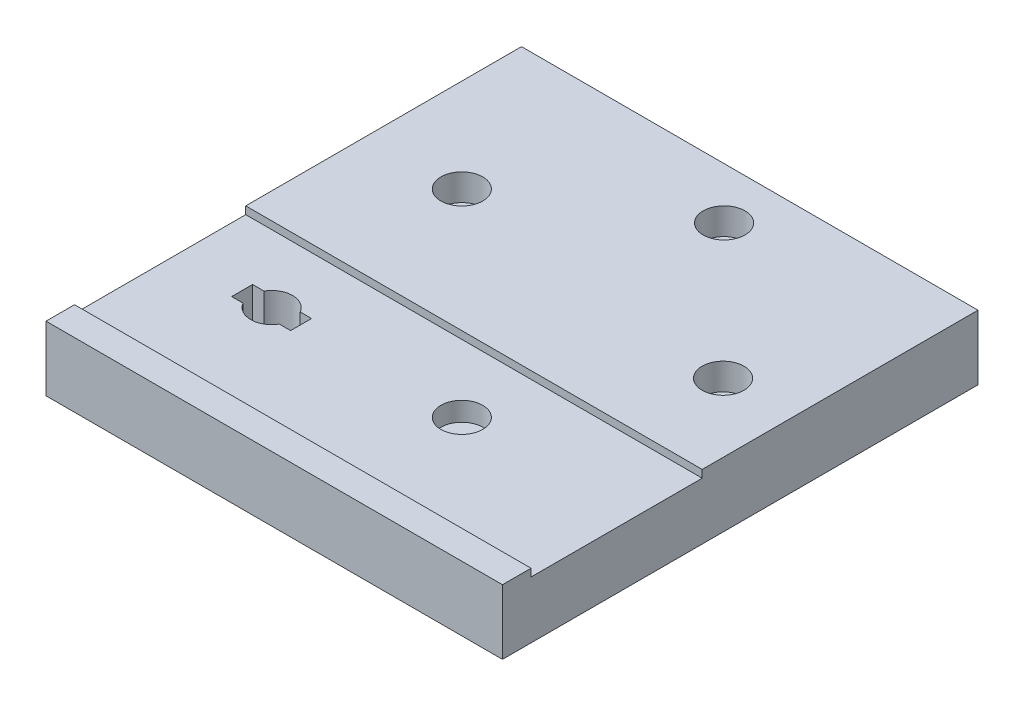
from build123d import *

# Parameters (mm, degrees)
SKETCH1_W           = 120
SKETCH1_H           = 55
BOSS_EXTRUDE1_DEPTH = 5
SKETCH2_W           = 120
SKETCH2_H           = 7.5
BOSS_EXTRUDE2_DEPTH = 20
SKETCH3_W           = 120
SKETCH3_H           = 2.5
BOSS_EXTRUDE4_DEPTH = 20
BOSS_EXTRUDE5_DEPTH = 190
SKETCH9_W           = 310
SKETCH9_H           = 25
BOSS_EXTRUDE6_DEPTH = 70
SKETCH14_R          = 5.5
CUT_EXTRUDE5_DEPTH  = 153
SKETCH15_W          = 125
SKETCH15_H          = 25
CUT_EXTRUDE6_DEPTH  = 190
SKETCH16_W          = 120
SKETCH16_H          = 125
BOSS_EXTRUDE8_DEPTH = 10
SKETCH17_W          = 120
SKETCH17_H          = 125
CUT_EXTRUDE7_DEPTH  = 18
CUT_EXTRUDE8_START  = -31
SKETCH18_R          = 5.5
CUT_EXTRUDE8_DEPTH  = 31
SKETCH19_W          = 15.5
SKETCH19_H          = 5.5
CUT_EXTRUDE9_DEPTH  = 31


with BuildPart() as part:
    # Sketch1 → Boss-Extrude1 (new body)
    with BuildSketch(Plane(origin=(0, 0, 0), x_dir=(1, 0, 0), z_dir=(0, 1, 0))):
        Rectangle(SKETCH1_W, SKETCH1_H)
    extrude(amount=BOSS_EXTRUDE1_DEPTH)

    # Sketch2 → Boss-Extrude2 (add)
    with BuildSketch(Plane(origin=(0, 5, 0), x_dir=(1, 0, 0), z_dir=(0, 1, 0))):
        with Locations((0, -23.75)):
            Rectangle(SKETCH2_W, SKETCH2_H)
    extrude(amount=BOSS_EXTRUDE2_DEPTH)

    # Sketch3 → Boss-Extrude4 (add)
    with BuildSketch(Plane(origin=(0, 5, 0), x_dir=(1, 0, 0), z_dir=(0, 1, 0))):
        with Locations((0, 26.25)):
            Rectangle(SKETCH3_W, SKETCH3_H)
    extrude(amount=BOSS_EXTRUDE4_DEPTH)

    # Sketch8 → Boss-Extrude5 (add)
    with BuildSketch(Plane.ZY.offset(60)):
        Polygon((-27.5, 0), (-27.5, 25), (-25, 25), (-25, 5), (20, 5), (20, 25), (27.5, 25), (27.5, 0), align=None)
    extrude(amount=BOSS_EXTRUDE5_DEPTH)

    # Sketch9 → Boss-Extrude6 (add)
    with BuildSketch(Plane(origin=(0, 0, -27.5), x_dir=(-1, 0, 0), z_dir=(0, 0, -1))):
        with Locations((95, 12.5)):
            Rectangle(SKETCH9_W, SKETCH9_H)
    extrude(amount=BOSS_EXTRUDE6_DEPTH)

    # Sketch14 → Cut-Extrude5 (cut)
    with BuildSketch(Plane(origin=(0, 0, 0), x_dir=(-1, 0, 0), z_dir=(0, -1, 0))):
        with Locations(Location((225.445279058, 7.255161462, 0), (0, 0, 90))):
            Circle(SKETCH14_R)
        with Locations(Location((175.445279058, 7.255161462, 0), (0, 0, 90))):
            Circle(SKETCH14_R)
        with Locations(Location((225.445279058, 57.255161462, 0), (0, 0, 90))):
            Circle(SKETCH14_R)
        with Locations(Location((148.0182107, 48.5, 0), (0, 0, 90))):
            Circle(SKETCH14_R)
        with Locations(Location((183.240850763, 83.987541856, 0), (0, 0, 90))):
            Circle(SKETCH14_R)
    extrude(amount=-CUT_EXTRUDE5_DEPTH, mode=Mode.SUBTRACT)

    # Sketch15 → Cut-Extrude6 (cut)
    with BuildSketch(Plane(origin=(60, 0, 0), x_dir=(0, 0, -1), z_dir=(1, 0, 0))):
        with Locations((35, 12.5)):
            Rectangle(SKETCH15_W, SKETCH15_H)
    extrude(amount=-CUT_EXTRUDE6_DEPTH, mode=Mode.SUBTRACT)

    # Sketch16 → Boss-Extrude8 (add)
    with BuildSketch(Plane(origin=(0, 0, 0), x_dir=(-1, 0, 0), z_dir=(0, -1, 0))):
        with Locations((190, 35)):
            Rectangle(SKETCH16_W, SKETCH16_H)
    extrude(amount=BOSS_EXTRUDE8_DEPTH)

    # Sketch17 → Cut-Extrude7 (cut)
    with BuildSketch(Plane(origin=(0, 25, 0), x_dir=(1, 0, 0), z_dir=(0, 1, 0))):
        with Locations((-190, 35)):
            Rectangle(SKETCH17_W, SKETCH17_H)
    extrude(amount=-CUT_EXTRUDE7_DEPTH, mode=Mode.SUBTRACT)

    # Sketch18 → Cut-Extrude8 (cut)
    with BuildSketch(Plane(origin=(0, 5, 0), x_dir=(1, 0, 0), z_dir=(0, 1, 0)).offset(CUT_EXTRUDE8_START)):
        with Locations(Location((-225.445279058, 7.255161462, 0), (0, 0, 90))):
            Circle(SKETCH18_R)
    extrude(amount=CUT_EXTRUDE8_DEPTH, mode=Mode.SUBTRACT)

    # Sketch19 → Cut-Extrude9 (cut)
    with BuildSketch(Plane(origin=(0, 5, 0), x_dir=(1, 0, 0), z_dir=(0, 1, 0))):
        with Locations((-225.445279058, 7.255161462)):
            Rectangle(SKETCH19_W, SKETCH19_H)
    extrude(amount=-CUT_EXTRUDE9_DEPTH, mode=Mode.SUBTRACT)


solid = part.part
